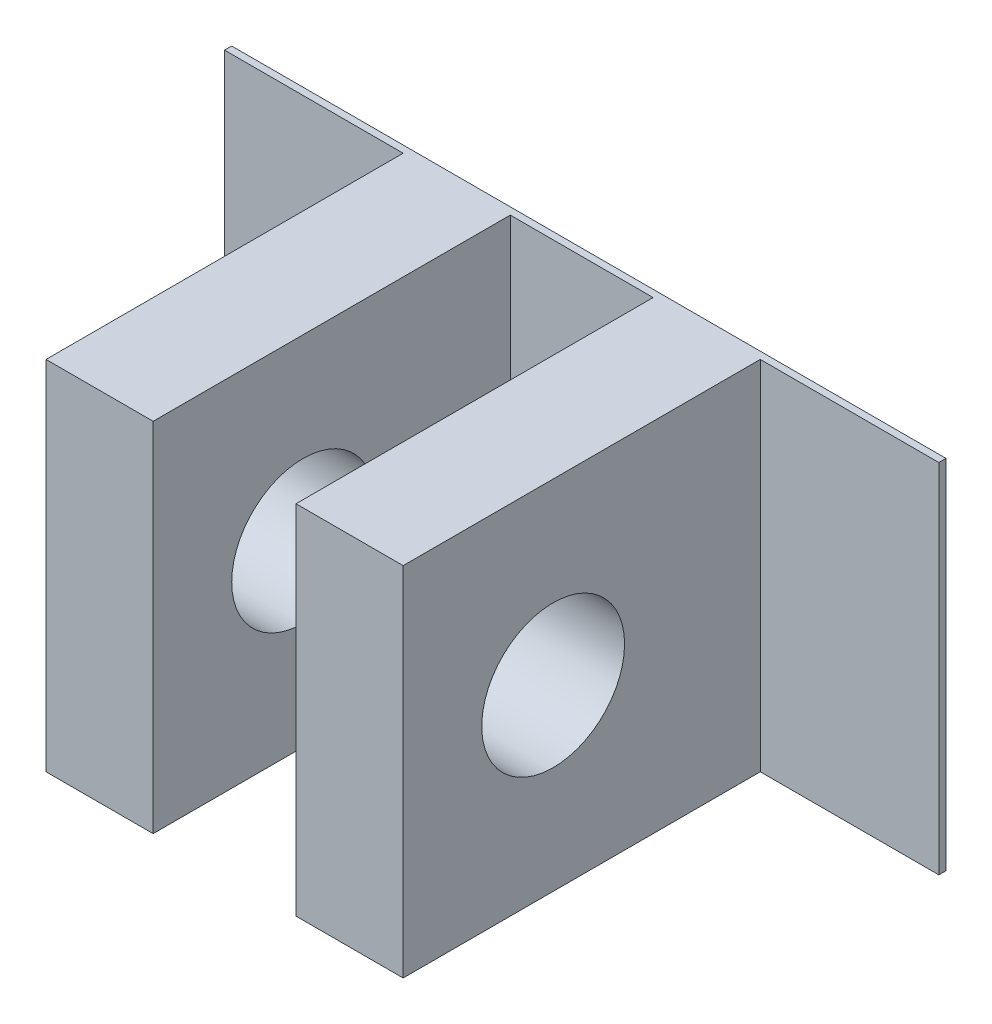
from build123d import *

# Parameters (mm, degrees)
SERVO_ROD_HOLDERS_W                 = 25.4
SERVO_ROD_HOLDERS_H                 = 25.4
BASE_OF_THE_HOLDERS_DEPTH           = 0.508
SERVO_ROD_HOLDERS_3_W               = 7.62
SERVO_ROD_HOLDERS_3_H               = 25.4
TWO_HOLDERS_EXTRUDE_DEPTH           = 25.908
SKETCH2_R                           = 5.08
PLACEMENT_FOR_ROD_EXTRUDE_CUT_DEPTH = 25.4
SERVO_ROD_HOLDERS_4_W               = 12.7
SERVO_ROD_HOLDERS_4_H               = 25.4
EXTENSION_FOR_SCREWS_DEPTH          = 0.508


with BuildPart() as part:
    # Servo Rod Holders → Base of the Holders (new body)
    with BuildSketch(Plane.XY):
        with Locations((3.091913881, 0.940064131)):
            Rectangle(SERVO_ROD_HOLDERS_W, SERVO_ROD_HOLDERS_H)
    extrude(amount=BASE_OF_THE_HOLDERS_DEPTH)

    # Servo Rod Holders<3> → Two Holders Extrude (add)
    with BuildSketch(Plane.XY):
        with Locations((-5.798086119, 0.940064131)):
            Rectangle(SERVO_ROD_HOLDERS_3_W, SERVO_ROD_HOLDERS_3_H)
        with Locations((11.981913881, 0.940064131)):
            Rectangle(SERVO_ROD_HOLDERS_3_W, SERVO_ROD_HOLDERS_3_H)
    extrude(amount=TWO_HOLDERS_EXTRUDE_DEPTH)

    # Sketch2 → Placement for Rod Extrude Cut (cut)
    with BuildSketch(Plane(origin=(15.791913881, 0, 0), x_dir=(0, 0, -1), z_dir=(1, 0, 0))):
        with Locations((-15.24, 0.940064131)):
            Circle(SKETCH2_R)
    extrude(amount=-PLACEMENT_FOR_ROD_EXTRUDE_CUT_DEPTH, mode=Mode.SUBTRACT)

    # Servo Rod Holders<4> → Extension for Screws (add)
    with BuildSketch(Plane.XY):
        with Locations((-15.958086119, 0.940064131)):
            Rectangle(SERVO_ROD_HOLDERS_4_W, SERVO_ROD_HOLDERS_4_H)
        with Locations((22.141913881, 0.940064131)):
            Rectangle(SERVO_ROD_HOLDERS_4_W, SERVO_ROD_HOLDERS_4_H)
    extrude(amount=EXTENSION_FOR_SCREWS_DEPTH)


solid = part.part
